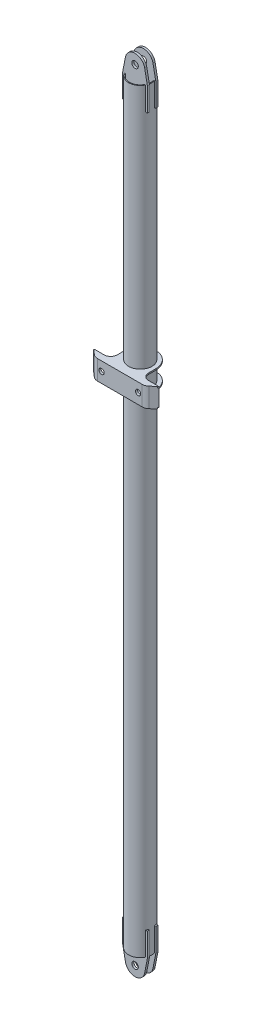
from build123d import *

# Parameters (mm, degrees)
SKETCH_1_R             = 90
SKETCH_1_R_2           = 84
EXTRUDE_1_DEPTH        = 5795
SKETCH_2_W             = 180
SKETCH_2_H             = 16
CUT_EXTRUDE_1_DEPTH    = 180
SKETCH_3_W             = 190
SKETCH_3_H             = 16
EXTRUDE_2_DEPTH        = 400
SKETCH_4_R             = 25
CUT_EXTRUDE_2_DEPTH    = 6018.154643185
SKETCH_5_R             = 90
EXTRUDE_3_DEPTH        = 10
PATTERN_LINEAR_1_COUNT = 2
PATTERN_LINEAR_1_PITCH = 140
EXTRUDE_START          = 130
EXTRUDE_4_DEPTH        = 130
SKETCH_7_R             = 20
CUT_EXTRUDE_3_DEPTH    = 16


with BuildPart() as part:
    # 草图1 → 凸台-拉伸1 (new body)
    with BuildSketch(Plane(origin=(0, 0, 0), x_dir=(1, 0, 0), z_dir=(0, 1, 0))):
        with Locations(Location((0, 0, 0), (0, 0, 270))):
            Circle(SKETCH_1_R)
        with Locations(Location((0, 0, 0), (0, 0, 270))):
            Circle(SKETCH_1_R_2, mode=Mode.SUBTRACT)
    extrude(amount=EXTRUDE_1_DEPTH)

    # 草图2 → 切除-拉伸1 (cut)
    with BuildSketch(Plane(origin=(0, 5795, 0), x_dir=(1, 0, 0), z_dir=(0, 1, 0))):
        with Locations((0, 32)):
            Rectangle(SKETCH_2_W, SKETCH_2_H)
        with Locations((0, -32)):
            Rectangle(SKETCH_2_W, SKETCH_2_H)
    cut_extrude_1 = extrude(amount=-CUT_EXTRUDE_1_DEPTH, mode=Mode.SUBTRACT)

    # 草图3 → 凸台-拉伸2 (add)
    with BuildSketch(Plane(origin=(0, 5615, 0), x_dir=(1, 0, 0), z_dir=(0, 1, 0))):
        with Locations((0, 32)):
            Rectangle(SKETCH_3_W, SKETCH_3_H)
        with Locations((0, -32)):
            Rectangle(SKETCH_3_W, SKETCH_3_H)
    extrude_2 = extrude(amount=EXTRUDE_2_DEPTH)

    # 草图4 → 切除-拉伸2 (cut, through all)
    with BuildSketch(Plane(origin=(0, 0, -40), x_dir=(-1, 0, 0), z_dir=(0, 0, -1))):
        with Locations((0, 5890)):
            Circle(SKETCH_4_R)
        with BuildLine():
            Line((95, 5795), (95, 6015))
            Line((95, 6015), (-95, 6015))
            Line((-95, 6015), (-95, 5795))
            Line((-95, 5795), (-73.605585808, 5904.395059493))
            ThreePointArc((-73.605585808, 5904.395059493), (0, 5965), (73.605585808, 5904.395059493))
            Line((73.605585808, 5904.395059493), (95, 5795))
        make_face()
    cut_extrude_2 = extrude(amount=-CUT_EXTRUDE_2_DEPTH, mode=Mode.SUBTRACT)

    # 镜向1: 切除-拉伸1, 凸台-拉伸2, 切除-拉伸2 across plane
    add(cut_extrude_1.mirror(Plane.ZX.offset(2897.5)), mode=Mode.SUBTRACT)
    add(extrude_2.mirror(Plane.ZX.offset(2897.5)))
    add(cut_extrude_2.mirror(Plane.ZX.offset(2897.5)), mode=Mode.SUBTRACT)

    # 草图5 → 凸台-拉伸3 (add)
    with BuildSketch(Plane(origin=(0, 3760, 0), x_dir=(1, 0, 0), z_dir=(0, 1, 0))):
        with BuildLine():
            Line((170, -107), (240, -107))
            Line((240, -107), (245, -112))
            Line((245, -112), (209.623877382, -142.613952265))
            ThreePointArc((209.623877382, -142.613952265), (191.616338968, -153.286631222), (171.01564946, -157))
            Line((171.01564946, -157), (-171.01564946, -157))
            ThreePointArc((-171.01564946, -157), (-191.616338968, -153.286631222), (-209.623877382, -142.613952265))
            Line((-209.623877382, -142.613952265), (-245, -112))
            Line((-245, -112), (-240, -107))
            Line((-240, -107), (-170, -107))
            ThreePointArc((-170, -107), (-134.644660941, -92.355339059), (-120, -57))
            Line((-120, -57), (-120, 0))
            ThreePointArc((-120, 0), (0, 120), (120, 0))
            Line((120, 0), (120, -57))
            ThreePointArc((120, -57), (134.644660941, -92.355339059), (170, -107))
        make_face()
        with Locations(Location((0, 0, 0), (0, 0, 90))):
            Circle(SKETCH_5_R, mode=Mode.SUBTRACT)
    extrude_3 = extrude(amount=EXTRUDE_3_DEPTH)

    # 阵列(线性)1: 凸台-拉伸3 ×2
    with Locations(*[(0, i * PATTERN_LINEAR_1_PITCH, 0) for i in range(1, PATTERN_LINEAR_1_COUNT)]):
        add(extrude_3)

    # 草图6 → 凸台-拉伸4 (add)
    with BuildSketch(Plane.XZ.offset(-3900).offset(EXTRUDE_START)):
        with BuildLine():
            Line((-250, 107.673076923), (-239.529972089, 95.574378004))
            Line((-239.529972089, 95.574378004), (-203.662019609, 126.613952265))
            ThreePointArc((-203.662019609, 126.613952265), (-185.654481194, 137.286631222), (-165.053791687, 141))
            Line((-165.053791687, 141), (165.053791687, 141))
            ThreePointArc((165.053791687, 141), (185.654481194, 137.286631222), (203.662019609, 126.613952265))
            Line((203.662019609, 126.613952265), (239.529972089, 95.574378004))
            Line((239.529972089, 95.574378004), (250, 107.673076923))
            Line((250, 107.673076923), (209.623877382, 142.613952265))
            ThreePointArc((209.623877382, 142.613952265), (191.616338968, 153.286631222), (171.01564946, 157))
            Line((171.01564946, 157), (-171.01564946, 157))
            ThreePointArc((-171.01564946, 157), (-191.616338968, 153.286631222), (-209.623877382, 142.613952265))
            Line((-209.623877382, 142.613952265), (-250, 107.673076923))
        make_face()
    extrude(amount=-EXTRUDE_4_DEPTH)

    # 草图7 → 切除-拉伸3 (cut)
    with BuildSketch(Plane.XY.offset(157)):
        with Locations((-140, 3840)):
            Circle(SKETCH_7_R)
        with Locations((140, 3840)):
            Circle(SKETCH_7_R)
    extrude(amount=-CUT_EXTRUDE_3_DEPTH, mode=Mode.SUBTRACT)


solid = part.part
